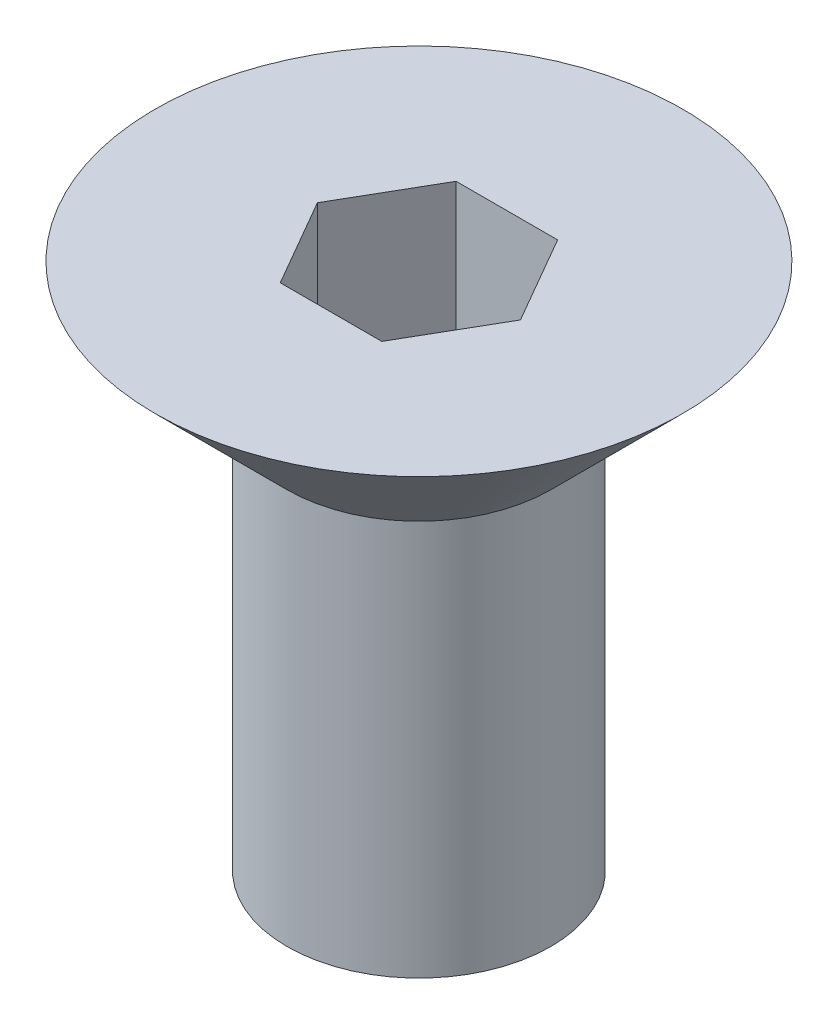
from build123d import *

# Parameters (mm, degrees)
CUT_EXTRUDE1_DEPTH = 1.5


with BuildPart() as part:
    # Sketch1 → Revolve1 (revolve)
    with BuildSketch(Plane.XY, mode=Mode.PRIVATE) as revolve1_sk:
        Polygon((0, -6), (1.5, -6), (1.5, -1.5), (3, 0), (0, 0), align=None)
    revolve(revolve1_sk.sketch.rotate(Axis((0, 61.691642626, 0), (0, -1, 0)), 90), axis=Axis((0, 61.691642626, 0), (0, -1, 0)))

    # Sketch2 → Cut-Extrude1 (cut)
    with BuildSketch(Plane(origin=(0, 0, 0), x_dir=(-1, 0, 0), z_dir=(0, 1, 0))):
        Polygon((-0.577350269, -1), (0.577350269, -1), (1.154700538, 0), (0.577350269, 1), (-0.577350269, 1), (-1.154700538, 0), align=None)
    extrude(amount=-CUT_EXTRUDE1_DEPTH, mode=Mode.SUBTRACT)


solid = part.part
